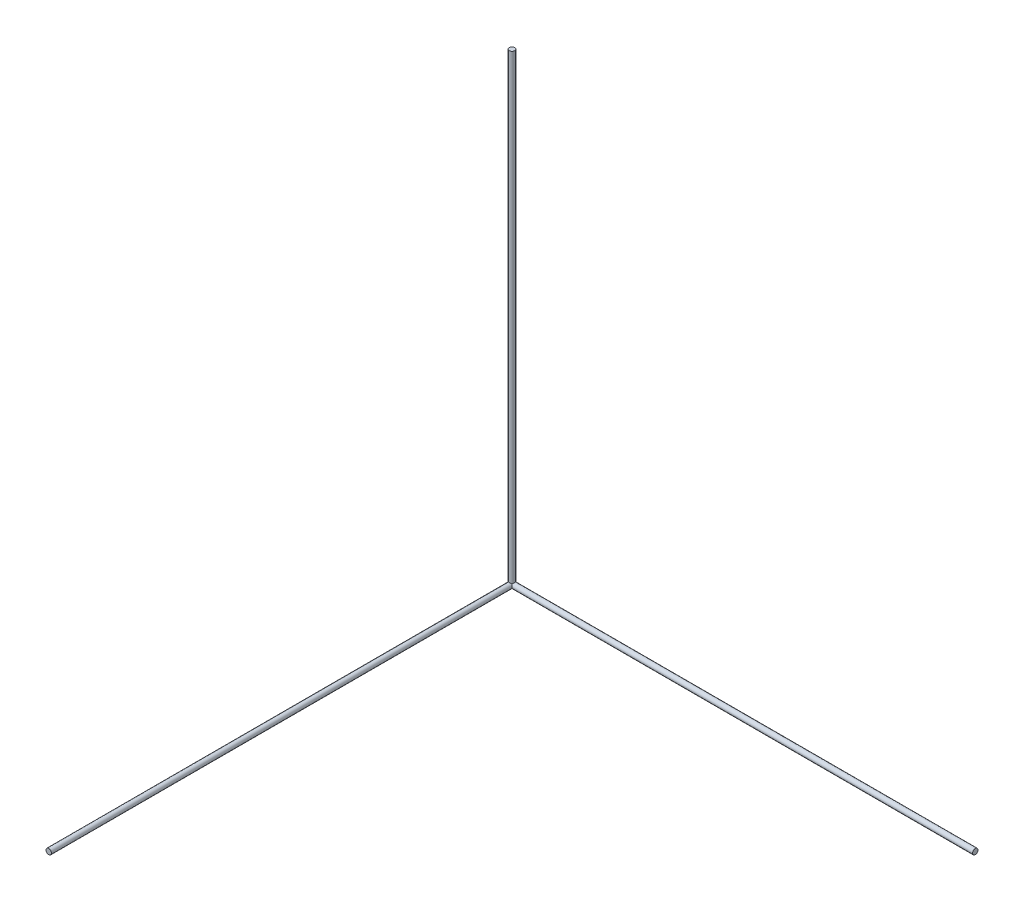
from build123d import *

# Parameters (mm, degrees)
SKETCH1_R           = 1.765617114
BOSS_EXTRUDE1_DEPTH = 300
SKETCH2_R           = 1.765617114
BOSS_EXTRUDE2_DEPTH = 300
SKETCH3_R           = 1.765617114
BOSS_EXTRUDE3_DEPTH = 300


with BuildPart() as part:
    # Sketch1 → Boss-Extrude1 (new body)
    with BuildSketch(Plane.XY):
        Circle(SKETCH1_R)
    extrude(amount=BOSS_EXTRUDE1_DEPTH)

    # Sketch2 → Boss-Extrude2 (add)
    with BuildSketch(Plane(origin=(0, 0, 0), x_dir=(0, 0, -1), z_dir=(1, 0, 0))):
        with Locations(Location((0, 0, 0), (0, 0, 90))):
            Circle(SKETCH2_R)
    extrude(amount=BOSS_EXTRUDE2_DEPTH)

    # Sketch3 → Boss-Extrude3 (add)
    with BuildSketch(Plane(origin=(0, 0, 0), x_dir=(1, 0, 0), z_dir=(0, 1, 0))):
        with Locations(Location((0, 0, 0), (0, 0, 90))):
            Circle(SKETCH3_R)
    extrude(amount=BOSS_EXTRUDE3_DEPTH)


solid = part.part
